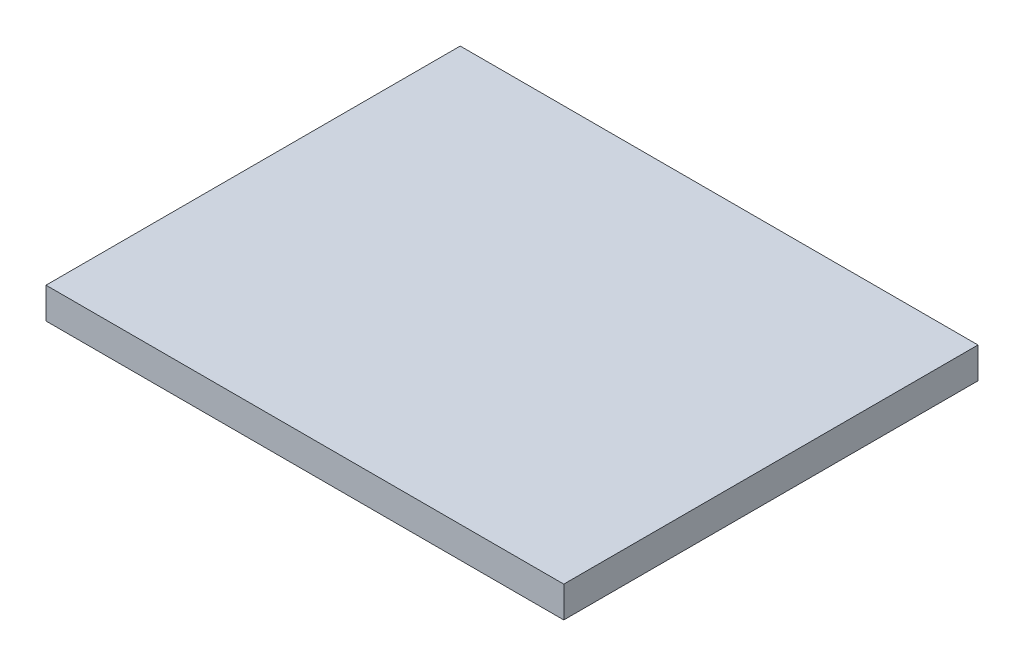
from build123d import *

# Parameters (mm, degrees)
SKETCH_1_W      = 50
SKETCH_1_H      = 40
EXTRUDE_1_DEPTH = 3


with BuildPart() as part:
    # 草图1 → 凸台-拉伸1 (new body)
    with BuildSketch(Plane(origin=(0, 0, 0), x_dir=(1, 0, 0), z_dir=(0, 1, 0))):
        with Locations((25, 20)):
            Rectangle(SKETCH_1_W, SKETCH_1_H)
    extrude(amount=EXTRUDE_1_DEPTH)


solid = part.part
